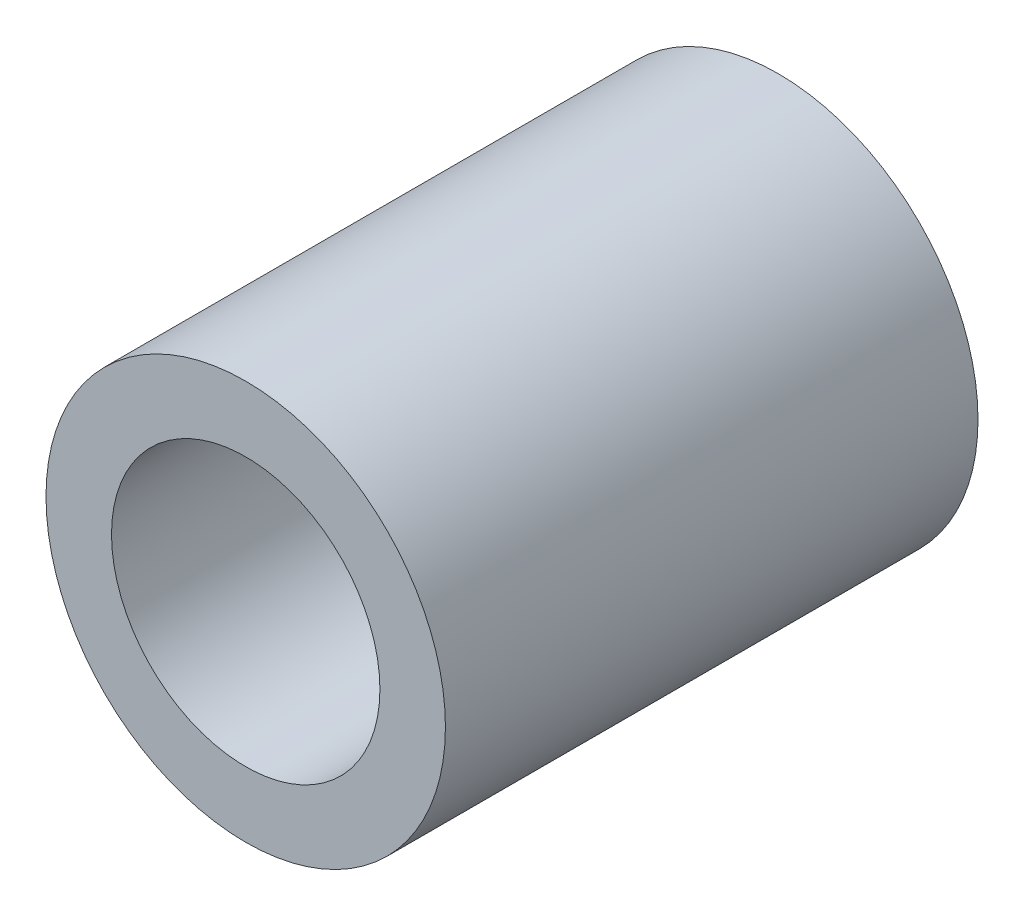
from build123d import *

# Parameters (mm, degrees)
SKETCH1_R      = 4.7625
SKETCH1_R_2    = 3.2004
EXTRUDE1_DEPTH = 6.35


with BuildPart() as part:
    # Sketch1 → Extrude1 (new, symmetric)
    with BuildSketch(Plane.XY):
        Circle(SKETCH1_R)
        Circle(SKETCH1_R_2, mode=Mode.SUBTRACT)
    extrude(amount=EXTRUDE1_DEPTH, both=True)


solid = part.part
